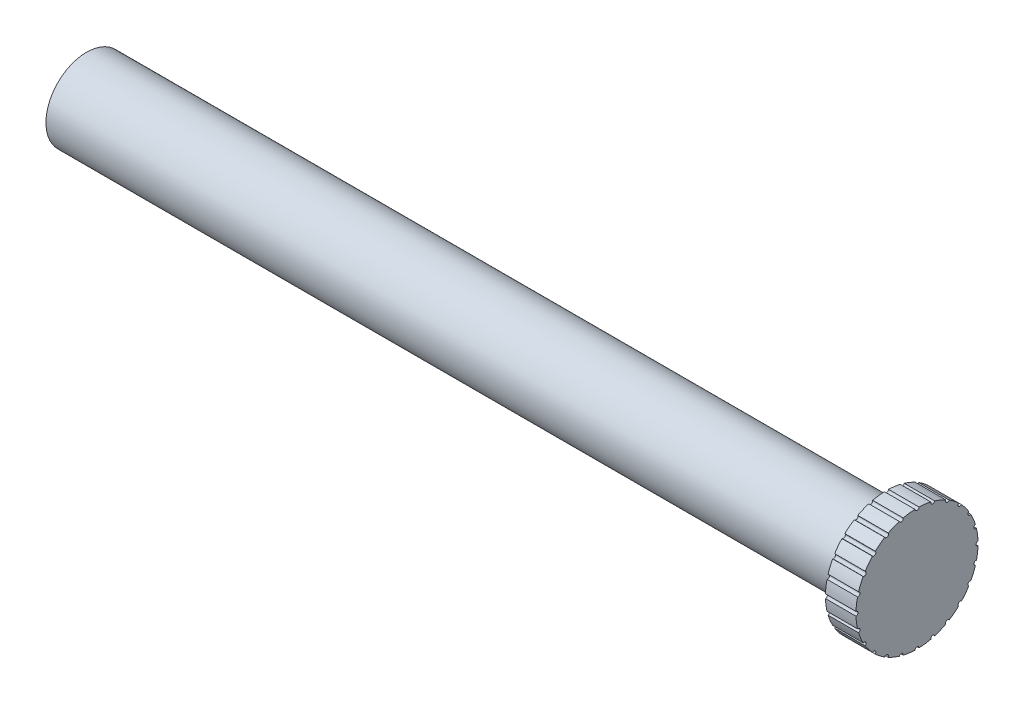
from build123d import *

# Parameters (mm, degrees)
SKETCH1_R           = 4
BOSS_EXTRUDE1_DEPTH = 78.63
SKETCH2_R           = 6
BOSS_EXTRUDE2_DEPTH = 3
CUT_EXTRUDE1_REACH  = 84.07
SKETCH3_R           = 0.2
CIRPATTERN1_COUNT   = 24


with BuildPart() as part:
    # Sketch1 → Boss-Extrude1 (new body)
    with BuildSketch(Plane(origin=(0, 0, 0), x_dir=(0, 0, -1), z_dir=(1, 0, 0))):
        Circle(SKETCH1_R)
    extrude(amount=BOSS_EXTRUDE1_DEPTH)

    # Sketch2 → Boss-Extrude2 (add)
    with BuildSketch(Plane(origin=(78.63, 0, 0), x_dir=(0, 0, -1), z_dir=(1, 0, 0))):
        Circle(SKETCH2_R)
    extrude(amount=BOSS_EXTRUDE2_DEPTH)

    # Sketch3 → Cut-Extrude1 (cut, up to next)
    with BuildSketch(Plane(origin=(81.63, 0, 0), x_dir=(0, 0, -1), z_dir=(1, 0, 0)), mode=Mode.PRIVATE) as cut_extrude1_sk1:
        with Locations((-6, 0)):
            Circle(SKETCH3_R)
    cut_extrude1_tool1 = extrude(cut_extrude1_sk1.sketch, amount=-CUT_EXTRUDE1_REACH, mode=Mode.PRIVATE) & part.part
    cut_extrude1 = cut_extrude1_tool1.solids().sort_by_distance((81.63, 0, 6))[0]
    add(cut_extrude1, mode=Mode.SUBTRACT)

    # CirPattern1: Cut-Extrude1 ×24 about axis
    cirpattern1_axis = Axis((0, 0, 0), (1, 0, 0))
    for i in range(1, CIRPATTERN1_COUNT):
        add(cut_extrude1.rotate(cirpattern1_axis, i * 360 / CIRPATTERN1_COUNT), mode=Mode.SUBTRACT)


solid = part.part
